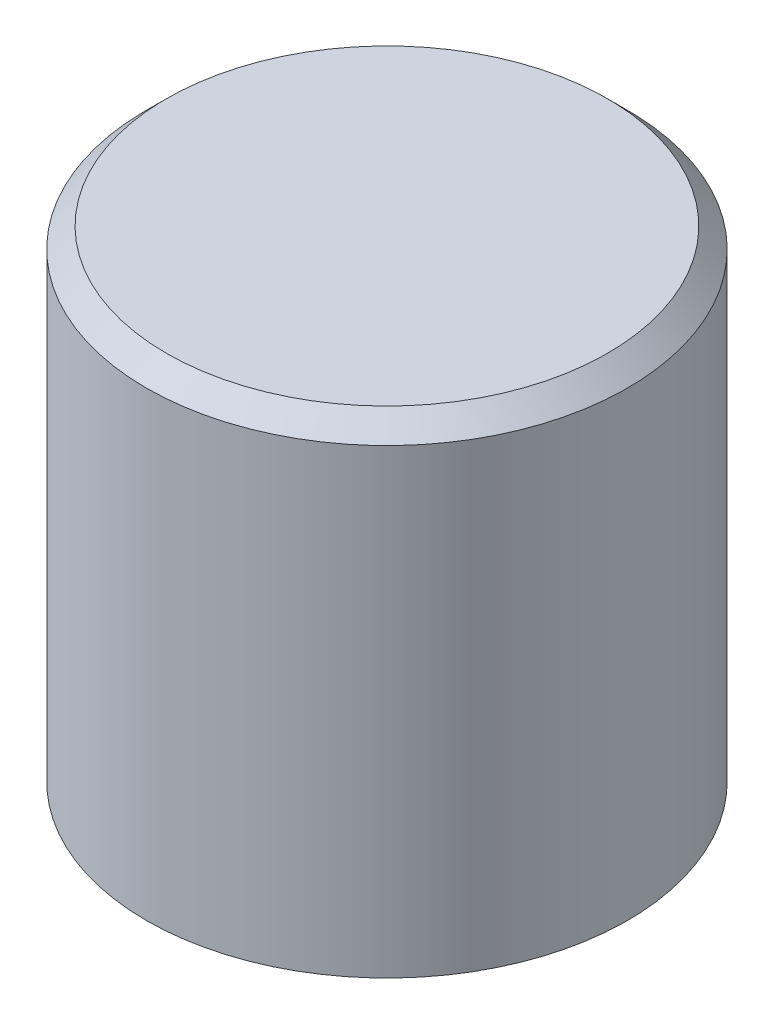
from build123d import *

# Parameters (mm, degrees)
SKETCH1_R           = 6
BOSS_EXTRUDE1_DEPTH = 12
CHAMFER1_SIZE       = 0.1
CHAMFER1_SIZE2      = 0.123280305
CHAMFER2_SIZE       = 0.5


with BuildPart() as part:
    # Sketch1 → Boss-Extrude1 (new body)
    with BuildSketch(Plane(origin=(0, 0, 0), x_dir=(1, 0, 0), z_dir=(0, 1, 0))):
        with Locations(Location((0, 0, 0), (0, 0, 270))):
            Circle(SKETCH1_R)
    extrude(amount=BOSS_EXTRUDE1_DEPTH)

    # Sketch2 → Cut-Revolve1 (revolve, cut)
    with BuildSketch(Plane.XY, mode=Mode.PRIVATE) as cut_revolve1_sk:
        Polygon((0, 0), (0, 8.5), (1.5, 8.5), (1.5, 3.617144432), (5, 3), (5, 0), align=None)
    revolve(cut_revolve1_sk.sketch.rotate(Axis((0, 0, 0), (0, 1, 0)), 90), axis=Axis((0, 0, 0), (0, 1, 0)), mode=Mode.SUBTRACT)

    # Chamfer1
    chamfer1_edges = [part.edges().sort_by_distance(p)[0] for p in [
        (0, 3.617144432, 1.5),
    ]]
    chamfer1_side = [part.faces().sort_by_distance(p)[0] for p in [
        (0, 3.308572216, 3.25),
    ]]
    chamfer(chamfer1_edges, length=CHAMFER1_SIZE, length2=CHAMFER1_SIZE2, reference=chamfer1_side[0])

    # Chamfer2
    chamfer2_edges = [part.edges().sort_by_distance(p)[0] for p in [
        (0, 12, -6),
    ]]
    chamfer(chamfer2_edges, length=CHAMFER2_SIZE)


solid = part.part
